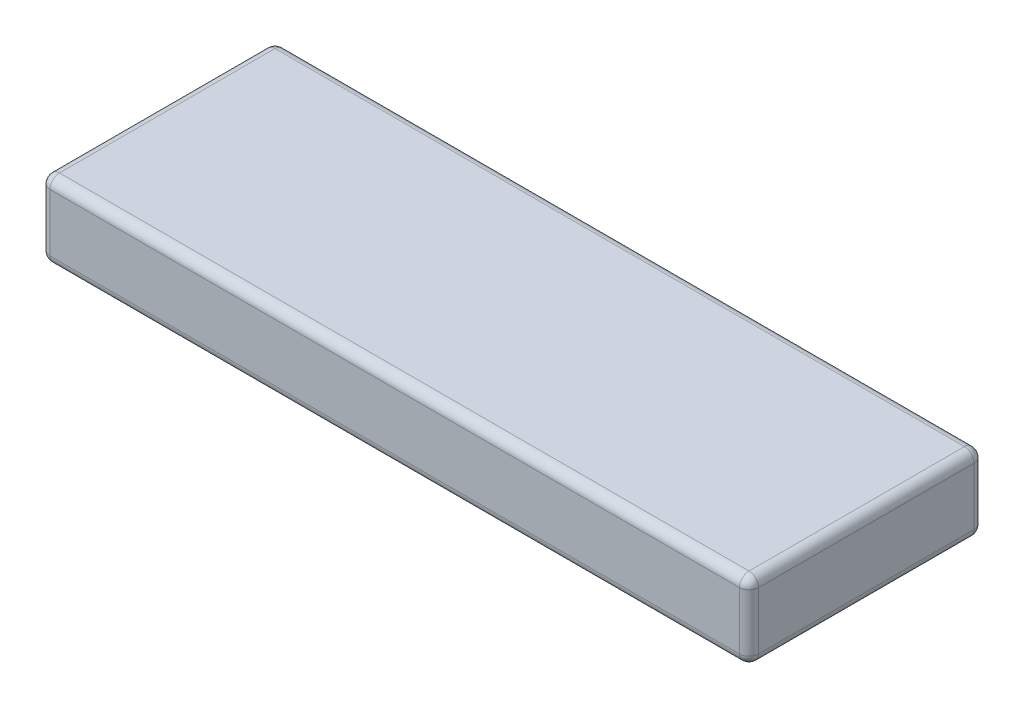
from build123d import *

# Parameters (mm, degrees)
SKETCH1_W           = 148
SKETCH1_H           = 49
BOSS_EXTRUDE1_DEPTH = 16
FILLET1_R           = 2


with BuildPart() as part:
    # Sketch1 → Boss-Extrude1 (new body)
    with BuildSketch(Plane(origin=(0, 0, 0), x_dir=(1, 0, 0), z_dir=(0, 1, 0))):
        with Locations((-11.964828379, 24.5)):
            Rectangle(SKETCH1_W, SKETCH1_H)
    extrude(amount=BOSS_EXTRUDE1_DEPTH)

    # Fillet1
    fillet1_edges = [part.edges().sort_by_distance(p)[0] for p in [
        (62.035171621, 16, -24.5),
        (-11.964828379, 16, -49),
        (-85.964828379, 16, -24.5),
        (-11.964828379, 0, -49),
        (62.035171621, 0, -24.5),
        (-11.964828379, 0, 0),
        (-85.964828379, 0, -24.5),
        (-11.964828379, 16, 0),
        (-85.964828379, 8, -49),
        (62.035171621, 8, -49),
        (62.035171621, 8, 0),
        (-85.964828379, 8, 0),
    ]]
    fillet(fillet1_edges, radius=FILLET1_R)


solid = part.part
